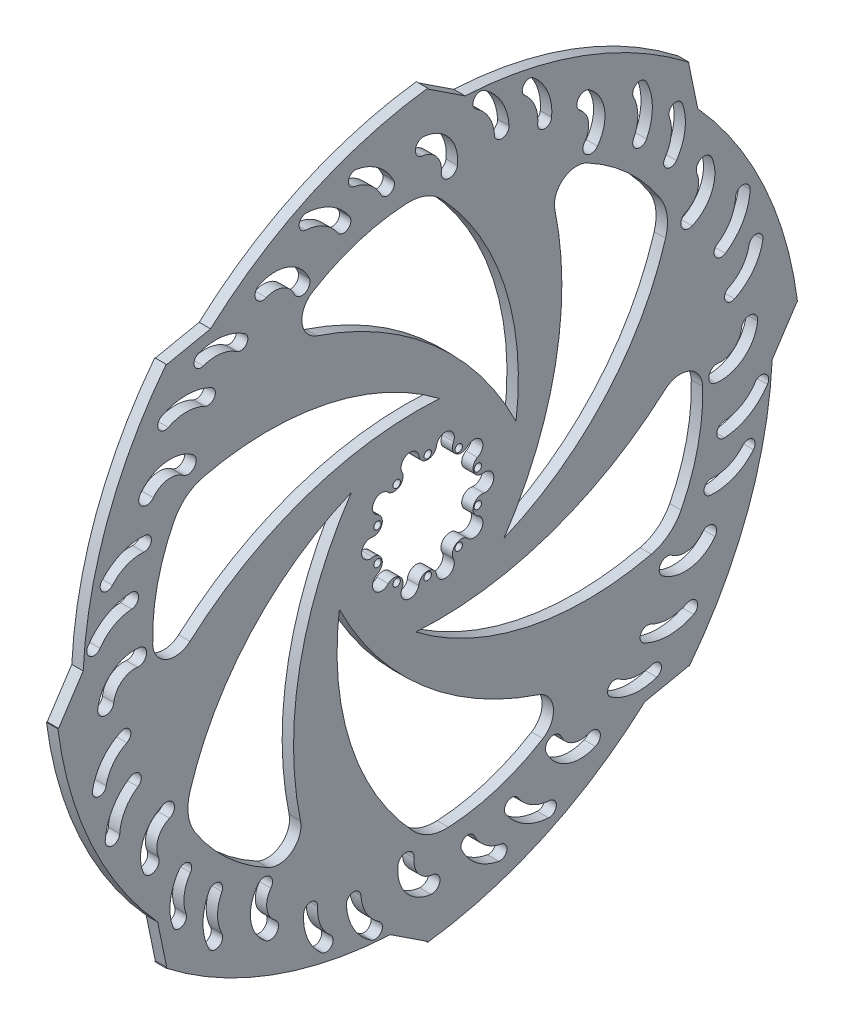
from build123d import *

# Parameters (mm, degrees)
SKETCH1_R           = 82.55
BOSS_EXTRUDE2_DEPTH = 2.54
SKETCH3_R           = 0.828391689
CUT_EXTRUDE2_DEPTH  = 117.770957862
CUT_EXTRUDE4_DEPTH  = 117.770957862
CIRPATTERN1_COUNT   = 8
CUT_EXTRUDE6_DEPTH  = 117.770957862
CUT_EXTRUDE8_DEPTH  = 10


with BuildPart() as part:
    # Sketch1 → Boss-Extrude2 (new body)
    with BuildSketch(Plane(origin=(0, 0, 0), x_dir=(0, 0, -1), z_dir=(1, 0, 0))):
        Circle(SKETCH1_R)
    extrude(amount=BOSS_EXTRUDE2_DEPTH)

    # Sketch3 → Cut-Extrude2 (cut, through all)
    with BuildSketch(Plane(origin=(2.54, 0, 0), x_dir=(0, 0, -1), z_dir=(1, 0, 0))):
        with Locations((0, 11.776895424)):
            Circle(SKETCH3_R)
        with Locations((6.922285448, 9.527708539)):
            Circle(SKETCH3_R)
        with Locations((11.200493134, 3.639260827)):
            Circle(SKETCH3_R)
        with Locations((11.200493134, -3.639260827)):
            Circle(SKETCH3_R)
        with Locations((6.922285448, -9.527708539)):
            Circle(SKETCH3_R)
        with Locations((0, -11.776895424)):
            Circle(SKETCH3_R)
        with Locations((-6.922285448, -9.527708539)):
            Circle(SKETCH3_R)
        with Locations((-11.200493134, -3.639260827)):
            Circle(SKETCH3_R)
        with Locations((-11.200493134, 3.639260827)):
            Circle(SKETCH3_R)
        with Locations((-6.922285448, 9.527708539)):
            Circle(SKETCH3_R)
        with BuildLine():
            ThreePointArc((-1.993087214, 12.583857414), (-0.147690437, 10.755460571), (1.946879465, 12.292113169))
            ThreePointArc((1.946879465, 12.292113169), (4.415851306, 14.068529159), (5.784164378, 11.352061773))
            ThreePointArc((5.784164378, 11.352061773), (6.318691462, 8.69693269), (9.009047232, 9.009047232))
            ThreePointArc((9.009047232, 9.009047232), (12.015393233, 8.547138755), (11.088875488, 5.650064267))
            ThreePointArc((11.088875488, 5.650064267), (10.274689716, 3.183158146), (12.583857414, 1.993087214))
            ThreePointArc((12.583857414, 1.993087214), (14.75, 0), (12.583857414, -1.993087214))
            ThreePointArc((12.583857414, -1.993087214), (10.22385755, -3.32193269), (11.352061773, -5.784164378))
            ThreePointArc((11.352061773, -5.784164378), (11.841772712, -8.786106902), (8.800181413, -8.800181413))
            ThreePointArc((8.800181413, -8.800181413), (6.202417032, -8.788160645), (5.784164378, -11.352061773))
            ThreePointArc((5.784164378, -11.352061773), (4.415851306, -14.068529159), (1.946879465, -12.292113169))
            ThreePointArc((1.946879465, -12.292113169), (-0.147690437, -10.755460571), (-1.993087214, -12.583857414))
            ThreePointArc((-1.993087214, -12.583857414), (-4.69677521, -13.977251449), (-5.650064267, -11.088875488))
            ThreePointArc((-5.650064267, -11.088875488), (-6.318691462, -8.69693269), (-8.800181413, -8.800181413))
            ThreePointArc((-8.800181413, -8.800181413), (-11.841772712, -8.786106902), (-11.352061773, -5.784164378))
            ThreePointArc((-11.352061773, -5.784164378), (-10.183412007, -3.464082051), (-12.292113169, -1.946879465))
            ThreePointArc((-12.292113169, -1.946879465), (-14.744539429, -0.147690437), (-12.583857414, 1.993087214))
            ThreePointArc((-12.583857414, 1.993087214), (-10.274689716, 3.183158146), (-11.088875488, 5.650064267))
            ThreePointArc((-11.088875488, 5.650064267), (-12.015393233, 8.547138755), (-9.009047232, 9.009047232))
            ThreePointArc((-9.009047232, 9.009047232), (-6.441385178, 8.614540123), (-5.650064267, 11.088875488))
            ThreePointArc((-5.650064267, 11.088875488), (-4.69677521, 13.977251449), (-1.993087214, 12.583857414))
        make_face()
    extrude(amount=-CUT_EXTRUDE2_DEPTH, mode=Mode.SUBTRACT)

    # Sketch4 → Cut-Extrude4 (cut, through all)
    with BuildSketch(Plane(origin=(2.54, 0, 0), x_dir=(0, 0, -1), z_dir=(1, 0, 0))):
        with BuildLine():
            Line((58.255925735, 58.255925735), (60.278168194, 48.46693796))
            ThreePointArc((60.278168194, 48.46693796), (75.128770111, 25.940464833), (82.55, 0))
            Line((82.55, 0), (84.19913667, 0))
            Line((84.19913667, 0), (99.514672131, 21.086766772))
            Line((99.514672131, 21.086766772), (74.929105232, 56.873705786))
            Line((74.929105232, 56.873705786), (59.699390986, 59.699390986))
            Line((59.699390986, 59.699390986), (58.255925735, 58.255925735))
        make_face()
    cut_extrude4 = extrude(amount=-CUT_EXTRUDE4_DEPTH, mode=Mode.SUBTRACT)

    # CirPattern1: Cut-Extrude4 ×8 about axis
    cirpattern1_axis = Axis((0, 0, 0), (1, 0, 0))
    for i in range(1, CIRPATTERN1_COUNT):
        add(cut_extrude4.rotate(cirpattern1_axis, i * 360 / CIRPATTERN1_COUNT), mode=Mode.SUBTRACT)

    # Sketch5 → Cut-Extrude6 (cut, through all)
    with BuildSketch(Plane(origin=(2.54, 0, 0), x_dir=(0, 0, -1), z_dir=(1, 0, 0))):
        with BuildLine():
            ThreePointArc((49.925830528, -32.483096842), (22.36885799, -32.744113701), (-2.669526614, -21.231765478))
            ThreePointArc((-2.669526614, -21.231765478), (27.103612639, -17.276325181), (53.054861571, -2.156205875))
            ThreePointArc((53.054861571, -2.156205875), (58.350704028, -1.306087904), (61.369131863, -5.739793049))
            ThreePointArc((61.369131863, -5.739793049), (60.325085784, -16.814160463), (56.561249432, -27.281499274))
            ThreePointArc((56.561249432, -27.281499274), (53.818531966, -30.615786692), (49.925830528, -32.483096842))
        make_face()
        with BuildLine():
            ThreePointArc((3.168271795, 59.478585963), (17.172805294, 35.744056124), (19.722011578, 8.304004875))
            ThreePointArc((19.722011578, 8.304004875), (1.409930171, 32.11057967), (-24.660101722, 47.024960852))
            ThreePointArc((-24.660101722, 47.024960852), (-28.044246709, 51.186235969), (-25.713759339, 56.017123726))
            ThreePointArc((-25.713759339, 56.017123726), (-15.601052787, 60.650137006), (-4.654153292, 62.624228515))
            ThreePointArc((-4.654153292, 62.624228515), (-0.395216951, 61.916109223), (3.168271795, 59.478585963))
        make_face()
        with BuildLine():
            ThreePointArc((28.394759849, 44.868754977), (28.51354281, 14.834254489), (17.052484964, -12.927760603))
            ThreePointArc((17.052484964, -12.927760603), (39.541663285, 2.999942423), (53.094102322, 26.995489121))
            ThreePointArc((53.094102322, 26.995489121), (53.423315015, 31.300322531), (51.90709614, 35.342729241))
            ThreePointArc((51.90709614, 35.342729241), (44.724032997, 43.835976542), (35.655372524, 50.277330677))
            ThreePointArc((35.655372524, 50.277330677), (30.306457319, 49.880148065), (28.394759849, 44.868754977))
        make_face()
        with BuildLine():
            ThreePointArc((24.660101722, -47.024960852), (-1.409930171, -32.11057967), (-19.722011578, -8.304004875))
            ThreePointArc((-19.722011578, -8.304004875), (-17.172805294, -35.744056124), (-3.168271795, -59.478585963))
            ThreePointArc((-3.168271795, -59.478585963), (0.395216951, -61.916109223), (4.654153292, -62.624228515))
            ThreePointArc((4.654153292, -62.624228515), (15.601052787, -60.650137006), (25.713759339, -56.017123726))
            ThreePointArc((25.713759339, -56.017123726), (28.044246709, -51.186235969), (24.660101722, -47.024960852))
        make_face()
        with BuildLine():
            ThreePointArc((-28.394759849, -44.868754977), (-28.51354281, -14.834254489), (-17.052484964, 12.927760603))
            ThreePointArc((-17.052484964, 12.927760603), (-39.541663285, -2.999942423), (-53.094102322, -26.995489121))
            ThreePointArc((-53.094102322, -26.995489121), (-53.423315015, -31.300322531), (-51.90709614, -35.342729241))
            ThreePointArc((-51.90709614, -35.342729241), (-44.724032997, -43.835976542), (-35.655372524, -50.277330677))
            ThreePointArc((-35.655372524, -50.277330677), (-30.306457319, -49.880148065), (-28.394759849, -44.868754977))
        make_face()
        with BuildLine():
            ThreePointArc((-53.054861571, 2.156205875), (-27.103612639, 17.276325181), (2.669526614, 21.231765478))
            ThreePointArc((2.669526614, 21.231765478), (-22.36885799, 32.744113701), (-49.925830528, 32.483096842))
            ThreePointArc((-49.925830528, 32.483096842), (-53.818531966, 30.615786692), (-56.561249432, 27.281499274))
            ThreePointArc((-56.561249432, 27.281499274), (-60.325085784, 16.814160463), (-61.369131863, 5.739793049))
            ThreePointArc((-61.369131863, 5.739793049), (-58.350704028, 1.306087904), (-53.054861571, 2.156205875))
        make_face()
    extrude(amount=-CUT_EXTRUDE6_DEPTH, mode=Mode.SUBTRACT)

    # Sketch6 → Cut-Extrude8 (cut)
    with BuildSketch(Plane(origin=(2.54, 0, 0), x_dir=(0, 0, -1), z_dir=(1, 0, 0))):
        with BuildLine():
            ThreePointArc((64.759191954, -3.032553959), (62.750686602, -4.620236418), (64.338369061, -6.62874177))
            ThreePointArc((64.338369061, -6.62874177), (70.513742703, -4.878300812), (73.642642609, 0.726096438))
            ThreePointArc((73.642642609, 0.726096438), (72.05496015, 2.73460179), (70.046454798, 1.146919331))
            ThreePointArc((70.046454798, 1.146919331), (68.268420637, -2.037845303), (64.759191954, -3.032553959))
        make_face()
        with BuildLine():
            ThreePointArc((67.146073645, 10.407367678), (66.411614847, 8.322246152), (68.496736373, 7.587787354))
            ThreePointArc((68.496736373, 7.587787354), (72.649786117, 10.962210984), (74.818456271, 15.854186738))
            ThreePointArc((74.818456271, 15.854186738), (73.563434186, 17.674099118), (71.743521806, 16.419077033))
            ThreePointArc((71.743521806, 16.419077033), (70.166364202, 12.861405181), (67.146073645, 10.407367678))
        make_face()
        with BuildLine():
            ThreePointArc((64.660869715, 20.126425744), (64.19286874, 17.872490412), (66.446804071, 17.404489437))
            ThreePointArc((66.446804071, 17.404489437), (70.350901163, 21.538006967), (71.978583805, 26.985812993))
            ThreePointArc((71.978583805, 26.985812993), (70.446315406, 28.703777761), (68.728350638, 27.171509362))
            ThreePointArc((68.728350638, 27.171509362), (67.531526395, 23.165773749), (64.660869715, 20.126425744))
        make_face()
        with BuildLine():
            ThreePointArc((57.599382341, 29.75332721), (56.653806912, 27.374101192), (59.03303293, 26.428525763))
            ThreePointArc((59.03303293, 26.428525763), (63.505842902, 31.032138921), (63.413351082, 37.450139266))
            ThreePointArc((63.413351082, 37.450139266), (61.034125064, 38.395714695), (60.088549635, 36.016488676))
            ThreePointArc((60.088549635, 36.016488676), (60.141109199, 32.369384517), (57.599382341, 29.75332721))
        make_face()
        with BuildLine():
            ThreePointArc((55.526020098, 40.819584794), (57.435454865, 45.818446252), (56.867590434, 51.139356607))
            ThreePointArc((56.867590434, 51.139356607), (54.870753236, 52.087935918), (53.922173925, 50.09109872))
            ThreePointArc((53.922173925, 50.09109872), (54.335151299, 46.221485716), (52.946521702, 42.586081618))
            ThreePointArc((52.946521702, 42.586081618), (53.353022488, 40.413084008), (55.526020098, 40.819584794))
        make_face()
        with BuildLine():
            ThreePointArc((48.842375607, 48.296132028), (50.156664103, 53.827911762), (48.842375607, 59.359691496))
            ThreePointArc((48.842375607, 59.359691496), (46.656409864, 60.081358428), (45.934742932, 57.895392685))
            ThreePointArc((45.934742932, 57.895392685), (46.90113054, 53.827911762), (45.934742932, 49.760430839))
            ThreePointArc((45.934742932, 49.760430839), (46.656409864, 47.574465096), (48.842375607, 48.296132028))
        make_face()
        with BuildLine():
            ThreePointArc((37.909843299, 52.40429116), (39.481603782, 58.627542091), (36.192503343, 64.139447521))
            ThreePointArc((36.192503343, 64.139447521), (33.659245456, 63.768726854), (34.029966122, 61.235468966))
            ThreePointArc((34.029966122, 61.235468966), (35.899036119, 58.103263896), (35.005864744, 54.566828382))
            ThreePointArc((35.005864744, 54.566828382), (35.376585411, 52.033570494), (37.909843299, 52.40429116))
        make_face()
        with BuildLine():
            ThreePointArc((14.900438876, 66.061168676), (16.618403644, 64.528900277), (18.150672043, 66.246865044))
            ThreePointArc((18.150672043, 66.246865044), (16.522989401, 71.69467107), (12.618892309, 75.8281886))
            ThreePointArc((12.618892309, 75.8281886), (10.364956978, 75.360187625), (10.832957953, 73.106252294))
            ThreePointArc((10.832957953, 73.106252294), (13.703614633, 70.066904289), (14.900438876, 66.061168676))
        make_face()
        with BuildLine():
            ThreePointArc((3.032553959, 64.759191954), (4.620236418, 62.750686602), (6.62874177, 64.338369061))
            ThreePointArc((6.62874177, 64.338369061), (4.878300812, 70.513742703), (-0.726096438, 73.642642609))
            ThreePointArc((-0.726096438, 73.642642609), (-2.73460179, 72.05496015), (-1.146919331, 70.046454798))
            ThreePointArc((-1.146919331, 70.046454798), (2.037845303, 68.268420637), (3.032553959, 64.759191954))
        make_face()
        with BuildLine():
            ThreePointArc((-10.407367678, 67.146073645), (-8.322246152, 66.411614847), (-7.587787354, 68.496736373))
            ThreePointArc((-7.587787354, 68.496736373), (-10.962210984, 72.649786117), (-15.854186738, 74.818456271))
            ThreePointArc((-15.854186738, 74.818456271), (-17.674099118, 73.563434186), (-16.419077033, 71.743521806))
            ThreePointArc((-16.419077033, 71.743521806), (-12.861405181, 70.166364202), (-10.407367678, 67.146073645))
        make_face()
        with BuildLine():
            ThreePointArc((-20.126425744, 64.660869715), (-17.872490412, 64.19286874), (-17.404489437, 66.446804071))
            ThreePointArc((-17.404489437, 66.446804071), (-21.538006967, 70.350901163), (-26.985812993, 71.978583805))
            ThreePointArc((-26.985812993, 71.978583805), (-28.703777761, 70.446315406), (-27.171509362, 68.728350638))
            ThreePointArc((-27.171509362, 68.728350638), (-23.165773749, 67.531526395), (-20.126425744, 64.660869715))
        make_face()
        with BuildLine():
            ThreePointArc((-29.75332721, 57.599382341), (-27.374101192, 56.653806912), (-26.428525763, 59.03303293))
            ThreePointArc((-26.428525763, 59.03303293), (-31.032138921, 63.505842902), (-37.450139266, 63.413351082))
            ThreePointArc((-37.450139266, 63.413351082), (-38.395714695, 61.034125064), (-36.016488676, 60.088549635))
            ThreePointArc((-36.016488676, 60.088549635), (-32.369384517, 60.141109199), (-29.75332721, 57.599382341))
        make_face()
        with BuildLine():
            ThreePointArc((-42.586081618, 52.946521702), (-40.413084008, 53.353022488), (-40.819584794, 55.526020098))
            ThreePointArc((-40.819584794, 55.526020098), (-45.818446252, 57.435454865), (-51.139356607, 56.867590434))
            ThreePointArc((-51.139356607, 56.867590434), (-52.087935918, 54.870753236), (-50.09109872, 53.922173925))
            ThreePointArc((-50.09109872, 53.922173925), (-46.221485716, 54.335151299), (-42.586081618, 52.946521702))
        make_face()
        with BuildLine():
            ThreePointArc((-49.760430839, 45.934742932), (-47.574465096, 46.656409864), (-48.296132028, 48.842375607))
            ThreePointArc((-48.296132028, 48.842375607), (-53.827911762, 50.156664103), (-59.359691496, 48.842375607))
            ThreePointArc((-59.359691496, 48.842375607), (-60.081358428, 46.656409864), (-57.895392685, 45.934742932))
            ThreePointArc((-57.895392685, 45.934742932), (-53.827911762, 46.90113054), (-49.760430839, 45.934742932))
        make_face()
        with BuildLine():
            ThreePointArc((-54.566828382, 35.005864744), (-52.033570494, 35.376585411), (-52.40429116, 37.909843299))
            ThreePointArc((-52.40429116, 37.909843299), (-58.627542091, 39.481603782), (-64.139447521, 36.192503343))
            ThreePointArc((-64.139447521, 36.192503343), (-63.768726854, 33.659245456), (-61.235468966, 34.029966122))
            ThreePointArc((-61.235468966, 34.029966122), (-58.103263896, 35.899036119), (-54.566828382, 35.005864744))
        make_face()
        with BuildLine():
            ThreePointArc((-63.35388938, 24.559992027), (-61.67526864, 25.998530839), (-63.113807452, 27.677151579))
            ThreePointArc((-63.113807452, 27.677151579), (-68.397665849, 26.831339865), (-72.721777172, 23.679099664))
            ThreePointArc((-72.721777172, 23.679099664), (-72.544852354, 21.475498268), (-70.341250958, 21.652423086))
            ThreePointArc((-70.341250958, 21.652423086), (-67.19655648, 23.944878486), (-63.35388938, 24.559992027))
        make_face()
        with BuildLine():
            ThreePointArc((-66.061168676, 14.900438876), (-64.528900277, 16.618403644), (-66.246865044, 18.150672043))
            ThreePointArc((-66.246865044, 18.150672043), (-71.69467107, 16.522989401), (-75.8281886, 12.618892309))
            ThreePointArc((-75.8281886, 12.618892309), (-75.360187625, 10.364956978), (-73.106252294, 10.832957953))
            ThreePointArc((-73.106252294, 10.832957953), (-70.066904289, 13.703614633), (-66.061168676, 14.900438876))
        make_face()
        with BuildLine():
            ThreePointArc((-64.759191954, 3.032553959), (-62.750686602, 4.620236418), (-64.338369061, 6.62874177))
            ThreePointArc((-64.338369061, 6.62874177), (-70.513742703, 4.878300812), (-73.642642609, -0.726096438))
            ThreePointArc((-73.642642609, -0.726096438), (-72.05496015, -2.73460179), (-70.046454798, -1.146919331))
            ThreePointArc((-70.046454798, -1.146919331), (-68.268420637, 2.037845303), (-64.759191954, 3.032553959))
        make_face()
        with BuildLine():
            ThreePointArc((-67.146073645, -10.407367678), (-66.411614847, -8.322246152), (-68.496736373, -7.587787354))
            ThreePointArc((-68.496736373, -7.587787354), (-72.649786117, -10.962210984), (-74.818456271, -15.854186738))
            ThreePointArc((-74.818456271, -15.854186738), (-73.563434186, -17.674099118), (-71.743521806, -16.419077033))
            ThreePointArc((-71.743521806, -16.419077033), (-70.166364202, -12.861405181), (-67.146073645, -10.407367678))
        make_face()
        with BuildLine():
            ThreePointArc((-64.660869715, -20.126425744), (-64.19286874, -17.872490412), (-66.446804071, -17.404489437))
            ThreePointArc((-66.446804071, -17.404489437), (-70.350901163, -21.538006967), (-71.978583805, -26.985812993))
            ThreePointArc((-71.978583805, -26.985812993), (-70.446315406, -28.703777761), (-68.728350638, -27.171509362))
            ThreePointArc((-68.728350638, -27.171509362), (-67.531526395, -23.165773749), (-64.660869715, -20.126425744))
        make_face()
        with BuildLine():
            ThreePointArc((-57.599382341, -29.75332721), (-56.653806912, -27.374101192), (-59.03303293, -26.428525763))
            ThreePointArc((-59.03303293, -26.428525763), (-63.505842902, -31.032138921), (-63.413351082, -37.450139266))
            ThreePointArc((-63.413351082, -37.450139266), (-61.034125064, -38.395714695), (-60.088549635, -36.016488676))
            ThreePointArc((-60.088549635, -36.016488676), (-60.141109199, -32.369384517), (-57.599382341, -29.75332721))
        make_face()
        with BuildLine():
            ThreePointArc((-52.946521702, -42.586081618), (-53.353022488, -40.413084008), (-55.526020098, -40.819584794))
            ThreePointArc((-55.526020098, -40.819584794), (-57.435454865, -45.818446252), (-56.867590434, -51.139356607))
            ThreePointArc((-56.867590434, -51.139356607), (-54.870753236, -52.087935918), (-53.922173925, -50.09109872))
            ThreePointArc((-53.922173925, -50.09109872), (-54.335151299, -46.221485716), (-52.946521702, -42.586081618))
        make_face()
        with BuildLine():
            ThreePointArc((-45.934742932, -49.760430839), (-46.656409864, -47.574465096), (-48.842375607, -48.296132028))
            ThreePointArc((-48.842375607, -48.296132028), (-50.156664103, -53.827911762), (-48.842375607, -59.359691496))
            ThreePointArc((-48.842375607, -59.359691496), (-46.656409864, -60.081358428), (-45.934742932, -57.895392685))
            ThreePointArc((-45.934742932, -57.895392685), (-46.90113054, -53.827911762), (-45.934742932, -49.760430839))
        make_face()
        with BuildLine():
            ThreePointArc((-35.005864744, -54.566828382), (-35.376585411, -52.033570494), (-37.909843299, -52.40429116))
            ThreePointArc((-37.909843299, -52.40429116), (-39.481603782, -58.627542091), (-36.192503343, -64.139447521))
            ThreePointArc((-36.192503343, -64.139447521), (-33.659245456, -63.768726854), (-34.029966122, -61.235468966))
            ThreePointArc((-34.029966122, -61.235468966), (-35.899036119, -58.103263896), (-35.005864744, -54.566828382))
        make_face()
        with BuildLine():
            ThreePointArc((-24.559992027, -63.35388938), (-25.998530839, -61.67526864), (-27.677151579, -63.113807452))
            ThreePointArc((-27.677151579, -63.113807452), (-26.831339865, -68.397665849), (-23.679099664, -72.721777172))
            ThreePointArc((-23.679099664, -72.721777172), (-21.475498268, -72.544852354), (-21.652423086, -70.341250958))
            ThreePointArc((-21.652423086, -70.341250958), (-23.944878486, -67.19655648), (-24.559992027, -63.35388938))
        make_face()
        with BuildLine():
            ThreePointArc((-14.900438876, -66.061168676), (-16.618403644, -64.528900277), (-18.150672043, -66.246865044))
            ThreePointArc((-18.150672043, -66.246865044), (-16.522989401, -71.69467107), (-12.618892309, -75.8281886))
            ThreePointArc((-12.618892309, -75.8281886), (-10.364956978, -75.360187625), (-10.832957953, -73.106252294))
            ThreePointArc((-10.832957953, -73.106252294), (-13.703614633, -70.066904289), (-14.900438876, -66.061168676))
        make_face()
        with BuildLine():
            ThreePointArc((-3.032553959, -64.759191954), (-4.620236418, -62.750686602), (-6.62874177, -64.338369061))
            ThreePointArc((-6.62874177, -64.338369061), (-4.878300812, -70.513742703), (0.726096438, -73.642642609))
            ThreePointArc((0.726096438, -73.642642609), (2.73460179, -72.05496015), (1.146919331, -70.046454798))
            ThreePointArc((1.146919331, -70.046454798), (-2.037845303, -68.268420637), (-3.032553959, -64.759191954))
        make_face()
        with BuildLine():
            ThreePointArc((10.407367678, -67.146073645), (8.322246152, -66.411614847), (7.587787354, -68.496736373))
            ThreePointArc((7.587787354, -68.496736373), (10.962210984, -72.649786117), (15.854186738, -74.818456271))
            ThreePointArc((15.854186738, -74.818456271), (17.674099118, -73.563434186), (16.419077033, -71.743521806))
            ThreePointArc((16.419077033, -71.743521806), (12.861405181, -70.166364202), (10.407367678, -67.146073645))
        make_face()
        with BuildLine():
            ThreePointArc((20.126425744, -64.660869715), (17.872490412, -64.19286874), (17.404489437, -66.446804071))
            ThreePointArc((17.404489437, -66.446804071), (21.538006967, -70.350901163), (26.985812993, -71.978583805))
            ThreePointArc((26.985812993, -71.978583805), (28.703777761, -70.446315406), (27.171509362, -68.728350638))
            ThreePointArc((27.171509362, -68.728350638), (23.165773749, -67.531526395), (20.126425744, -64.660869715))
        make_face()
        with BuildLine():
            ThreePointArc((29.75332721, -57.599382341), (27.374101192, -56.653806912), (26.428525763, -59.03303293))
            ThreePointArc((26.428525763, -59.03303293), (31.032138921, -63.505842902), (37.450139266, -63.413351082))
            ThreePointArc((37.450139266, -63.413351082), (38.395714695, -61.034125064), (36.016488676, -60.088549635))
            ThreePointArc((36.016488676, -60.088549635), (32.369384517, -60.141109199), (29.75332721, -57.599382341))
        make_face()
        with BuildLine():
            ThreePointArc((42.586081618, -52.946521702), (40.413084008, -53.353022488), (40.819584794, -55.526020098))
            ThreePointArc((40.819584794, -55.526020098), (45.818446252, -57.435454865), (51.139356607, -56.867590434))
            ThreePointArc((51.139356607, -56.867590434), (52.087935918, -54.870753236), (50.09109872, -53.922173925))
            ThreePointArc((50.09109872, -53.922173925), (46.221485716, -54.335151299), (42.586081618, -52.946521702))
        make_face()
        with BuildLine():
            ThreePointArc((75.8281886, -12.618892309), (75.360187625, -10.364956978), (73.106252294, -10.832957953))
            ThreePointArc((73.106252294, -10.832957953), (70.066904289, -13.703614633), (66.061168676, -14.900438876))
            ThreePointArc((66.061168676, -14.900438876), (64.528900277, -16.618403644), (66.246865044, -18.150672043))
            ThreePointArc((66.246865044, -18.150672043), (71.69467107, -16.522989401), (75.8281886, -12.618892309))
        make_face()
        with BuildLine():
            ThreePointArc((27.677151579, 63.113807452), (26.831339865, 68.397665849), (23.679099664, 72.721777172))
            ThreePointArc((23.679099664, 72.721777172), (21.475498268, 72.544852354), (21.652423086, 70.341250958))
            ThreePointArc((21.652423086, 70.341250958), (23.944878486, 67.19655648), (24.559992027, 63.35388938))
            ThreePointArc((24.559992027, 63.35388938), (25.998530839, 61.67526864), (27.677151579, 63.113807452))
        make_face()
        with BuildLine():
            ThreePointArc((52.40429116, -37.909843299), (58.627542091, -39.481603782), (64.139447521, -36.192503343))
            ThreePointArc((64.139447521, -36.192503343), (63.768726854, -33.659245456), (61.235468966, -34.029966122))
            ThreePointArc((61.235468966, -34.029966122), (58.103263896, -35.899036119), (54.566828382, -35.005864744))
            ThreePointArc((54.566828382, -35.005864744), (52.033570494, -35.376585411), (52.40429116, -37.909843299))
        make_face()
        with BuildLine():
            ThreePointArc((49.760430839, -45.934742932), (53.827911762, -46.90113054), (57.895392685, -45.934742932))
            ThreePointArc((57.895392685, -45.934742932), (60.081358428, -46.656409864), (59.359691496, -48.842375607))
            ThreePointArc((59.359691496, -48.842375607), (53.827911762, -50.156664103), (48.296132028, -48.842375607))
            ThreePointArc((48.296132028, -48.842375607), (47.574465096, -46.656409864), (49.760430839, -45.934742932))
        make_face()
        with BuildLine():
            ThreePointArc((63.35388938, -24.559992027), (67.19655648, -23.944878486), (70.341250958, -21.652423086))
            ThreePointArc((70.341250958, -21.652423086), (72.544852354, -21.475498268), (72.721777172, -23.679099664))
            ThreePointArc((72.721777172, -23.679099664), (68.397665849, -26.831339865), (63.113807452, -27.677151579))
            ThreePointArc((63.113807452, -27.677151579), (61.67526864, -25.998530839), (63.35388938, -24.559992027))
        make_face()
    extrude(amount=-CUT_EXTRUDE8_DEPTH, mode=Mode.SUBTRACT)


solid = part.part
